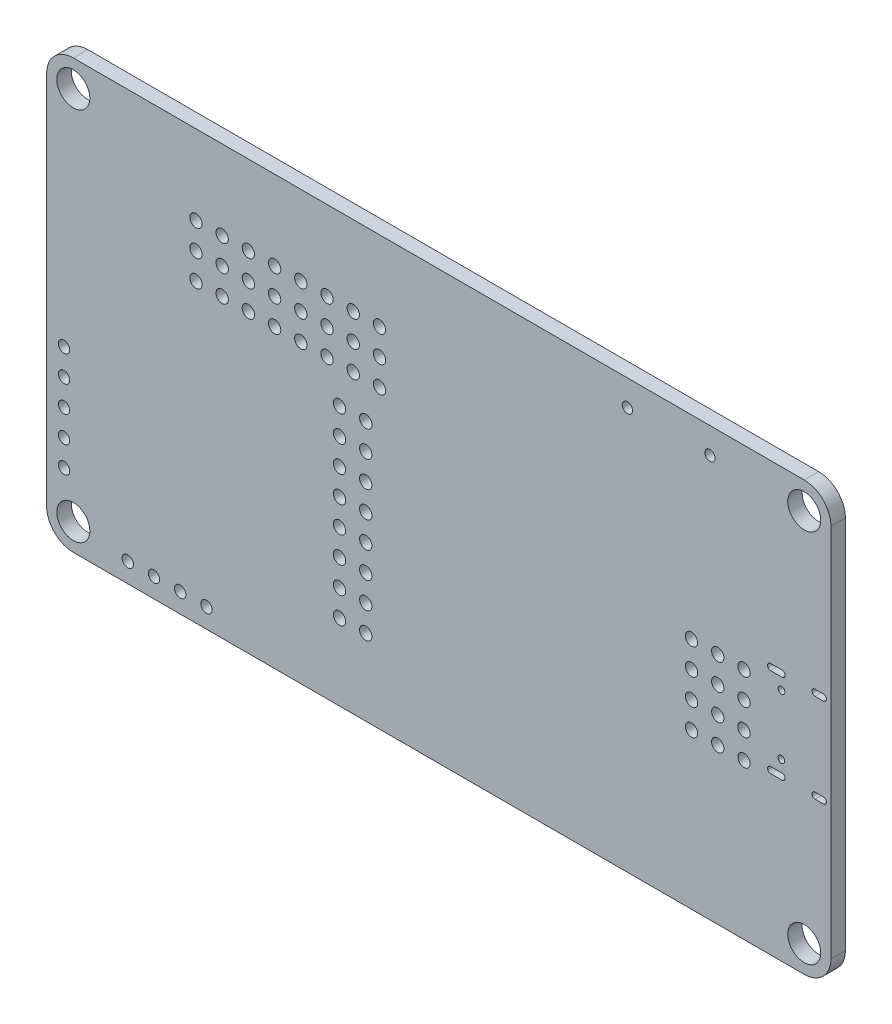
from build123d import *

# Parameters (mm, degrees)
SKETCH_1_R      = 1.6
SKETCH_1_R_2    = 0.599441199
SKETCH_1_R_3    = 0.6
SKETCH_1_R_4    = 0.5
SKETCH_1_R_5    = 0.32499365
SKETCH_1_R_6    = 0.5500127
EXTRUDE_1_DEPTH = 1.399034798


with BuildPart() as part:
    # 草图1 → 凸台-拉伸1 (new body)
    with BuildSketch(Plane.XY.offset(1.399034798)):
        with BuildLine():
            Line((40.06507493, 133.362966726), (110.86507493, 133.362966726))
            ThreePointArc((110.86507493, 133.362966726), (112.694572287, 134.120769344), (113.452374905, 135.950266701))
            Line((113.452374905, 135.950266701), (113.452374905, 172.250266701))
            ThreePointArc((113.452374905, 172.250266701), (112.694572287, 174.079764058), (110.86507493, 174.837566675))
            Line((110.86507493, 174.837566675), (40.06507493, 174.837566675))
            ThreePointArc((40.06507493, 174.837566675), (38.235577573, 174.079764058), (37.477774956, 172.250266701))
            Line((37.477774956, 172.250266701), (37.477774956, 135.950266701))
            ThreePointArc((37.477774956, 135.950266701), (38.235577573, 134.120769344), (40.06507493, 133.362966726))
        make_face()
        with Locations(Location((40.06507493, 172.250266701, 0), (0, 0, 180))):
            Circle(SKETCH_1_R, mode=Mode.SUBTRACT)
        with Locations(Location((51.943103886, 167.132334265, 0), (0, 0, 180))):
            Circle(SKETCH_1_R_2, mode=Mode.SUBTRACT)
        with Locations(Location((54.483108966, 167.132334265, 0), (0, 0, 180))):
            Circle(SKETCH_1_R_2, mode=Mode.SUBTRACT)
        with Locations(Location((57.023114046, 167.132334265, 0), (0, 0, 180))):
            Circle(SKETCH_1_R_2, mode=Mode.SUBTRACT)
        with Locations(Location((51.943103886, 164.592329185, 0), (0, 0, 180))):
            Circle(SKETCH_1_R_2, mode=Mode.SUBTRACT)
        with Locations(Location((54.483108966, 164.592329185, 0), (0, 0, 180))):
            Circle(SKETCH_1_R_2, mode=Mode.SUBTRACT)
        with Locations(Location((57.023114046, 164.592329185, 0), (0, 0, 180))):
            Circle(SKETCH_1_R_2, mode=Mode.SUBTRACT)
        with Locations(Location((59.563119126, 167.132334265, 0), (0, 0, 180))):
            Circle(SKETCH_1_R_2, mode=Mode.SUBTRACT)
        with Locations(Location((62.103124206, 167.132334265, 0), (0, 0, 180))):
            Circle(SKETCH_1_R_2, mode=Mode.SUBTRACT)
        with Locations(Location((64.643129286, 167.132334265, 0), (0, 0, 180))):
            Circle(SKETCH_1_R_2, mode=Mode.SUBTRACT)
        with Locations(Location((59.563119126, 164.592329185, 0), (0, 0, 180))):
            Circle(SKETCH_1_R_2, mode=Mode.SUBTRACT)
        with Locations(Location((62.103124206, 164.592329185, 0), (0, 0, 180))):
            Circle(SKETCH_1_R_2, mode=Mode.SUBTRACT)
        with Locations(Location((64.643129286, 164.592329185, 0), (0, 0, 180))):
            Circle(SKETCH_1_R_2, mode=Mode.SUBTRACT)
        with Locations(Location((67.183134366, 167.132334265, 0), (0, 0, 180))):
            Circle(SKETCH_1_R_2, mode=Mode.SUBTRACT)
        with Locations(Location((69.723139446, 167.132334265, 0), (0, 0, 180))):
            Circle(SKETCH_1_R_2, mode=Mode.SUBTRACT)
        with Locations(Location((67.183134366, 164.592329185, 0), (0, 0, 180))):
            Circle(SKETCH_1_R_2, mode=Mode.SUBTRACT)
        with Locations(Location((69.723139446, 164.592329185, 0), (0, 0, 180))):
            Circle(SKETCH_1_R_2, mode=Mode.SUBTRACT)
        with Locations(Location((51.943103886, 162.052324105, 0), (0, 0, 180))):
            Circle(SKETCH_1_R_2, mode=Mode.SUBTRACT)
        with Locations(Location((54.483108966, 162.052324105, 0), (0, 0, 180))):
            Circle(SKETCH_1_R_2, mode=Mode.SUBTRACT)
        with Locations(Location((57.023114046, 162.052324105, 0), (0, 0, 180))):
            Circle(SKETCH_1_R_2, mode=Mode.SUBTRACT)
        with Locations(Location((59.563119126, 162.052324105, 0), (0, 0, 180))):
            Circle(SKETCH_1_R_2, mode=Mode.SUBTRACT)
        with Locations(Location((62.103124206, 162.052324105, 0), (0, 0, 180))):
            Circle(SKETCH_1_R_2, mode=Mode.SUBTRACT)
        with Locations(Location((64.643129286, 162.052324105, 0), (0, 0, 180))):
            Circle(SKETCH_1_R_2, mode=Mode.SUBTRACT)
        with Locations(Location((67.183134366, 162.052324105, 0), (0, 0, 180))):
            Circle(SKETCH_1_R_2, mode=Mode.SUBTRACT)
        with Locations(Location((69.723139446, 162.052324105, 0), (0, 0, 180))):
            Circle(SKETCH_1_R_2, mode=Mode.SUBTRACT)
        with Locations(Location((65.851363983, 158.524160528, 0), (0, 0, 180))):
            Circle(SKETCH_1_R_3, mode=Mode.SUBTRACT)
        with Locations(Location((65.851363983, 155.984155448, 0), (0, 0, 180))):
            Circle(SKETCH_1_R_3, mode=Mode.SUBTRACT)
        with Locations(Location((68.391369063, 158.524160528, 0), (0, 0, 180))):
            Circle(SKETCH_1_R_3, mode=Mode.SUBTRACT)
        with Locations(Location((68.391369063, 155.984155448, 0), (0, 0, 180))):
            Circle(SKETCH_1_R_3, mode=Mode.SUBTRACT)
        with Locations(Location((93.734188468, 172.334264669, 0), (0, 0, 180))):
            Circle(SKETCH_1_R_4, mode=Mode.SUBTRACT)
        with Locations(Location((101.734188468, 172.334264669, 0), (0, 0, 180))):
            Circle(SKETCH_1_R_4, mode=Mode.SUBTRACT)
        with Locations(Location((110.86507493, 172.250266701, 0), (0, 0, 180))):
            Circle(SKETCH_1_R, mode=Mode.SUBTRACT)
        with Locations(Location((99.949199898, 156.01981204, 0), (0, 0, 180))):
            Circle(SKETCH_1_R_2, mode=Mode.SUBTRACT)
        with Locations(Location((102.489204978, 156.01981204, 0), (0, 0, 180))):
            Circle(SKETCH_1_R_2, mode=Mode.SUBTRACT)
        with Locations(Location((105.029210058, 156.01981204, 0), (0, 0, 180))):
            Circle(SKETCH_1_R_2, mode=Mode.SUBTRACT)
        with Locations(Location((108.662529845, 156.095684531, 0), (0, 0, 180))):
            Circle(SKETCH_1_R_5, mode=Mode.SUBTRACT)
        with Locations(Location((39.168275337, 150.163637287, 0), (0, 0, 180))):
            Circle(SKETCH_1_R_6, mode=Mode.SUBTRACT)
        with Locations(Location((39.168275337, 147.623632207, 0), (0, 0, 180))):
            Circle(SKETCH_1_R_6, mode=Mode.SUBTRACT)
        with Locations(Location((39.168275337, 145.083627127, 0), (0, 0, 180))):
            Circle(SKETCH_1_R_6, mode=Mode.SUBTRACT)
        with Locations(Location((65.851363983, 153.444150368, 0), (0, 0, 180))):
            Circle(SKETCH_1_R_3, mode=Mode.SUBTRACT)
        with Locations(Location((65.851363983, 150.904145288, 0), (0, 0, 180))):
            Circle(SKETCH_1_R_3, mode=Mode.SUBTRACT)
        with Locations(Location((68.391369063, 153.444150368, 0), (0, 0, 180))):
            Circle(SKETCH_1_R_3, mode=Mode.SUBTRACT)
        with Locations(Location((68.391369063, 150.904145288, 0), (0, 0, 180))):
            Circle(SKETCH_1_R_3, mode=Mode.SUBTRACT)
        with Locations(Location((65.851363983, 148.364140208, 0), (0, 0, 180))):
            Circle(SKETCH_1_R_3, mode=Mode.SUBTRACT)
        with Locations(Location((65.851363983, 145.824135128, 0), (0, 0, 180))):
            Circle(SKETCH_1_R_3, mode=Mode.SUBTRACT)
        with Locations(Location((68.391369063, 148.364140208, 0), (0, 0, 180))):
            Circle(SKETCH_1_R_3, mode=Mode.SUBTRACT)
        with Locations(Location((68.391369063, 145.824135128, 0), (0, 0, 180))):
            Circle(SKETCH_1_R_3, mode=Mode.SUBTRACT)
        with Locations(Location((39.168275337, 142.543622047, 0), (0, 0, 180))):
            Circle(SKETCH_1_R_6, mode=Mode.SUBTRACT)
        with Locations(Location((39.168275337, 140.003616967, 0), (0, 0, 180))):
            Circle(SKETCH_1_R_6, mode=Mode.SUBTRACT)
        with Locations(Location((40.06507493, 135.950266701, 0), (0, 0, 180))):
            Circle(SKETCH_1_R, mode=Mode.SUBTRACT)
        with Locations(Location((45.339090678, 135.255270511, 0), (0, 0, 180))):
            Circle(SKETCH_1_R_6, mode=Mode.SUBTRACT)
        with Locations(Location((47.879095758, 135.255270511, 0), (0, 0, 180))):
            Circle(SKETCH_1_R_6, mode=Mode.SUBTRACT)
        with Locations(Location((50.419100838, 135.255270511, 0), (0, 0, 180))):
            Circle(SKETCH_1_R_6, mode=Mode.SUBTRACT)
        with Locations(Location((52.959105918, 135.255270511, 0), (0, 0, 180))):
            Circle(SKETCH_1_R_6, mode=Mode.SUBTRACT)
        with Locations(Location((65.851363983, 143.284130048, 0), (0, 0, 180))):
            Circle(SKETCH_1_R_3, mode=Mode.SUBTRACT)
        with Locations(Location((65.851363983, 140.744124968, 0), (0, 0, 180))):
            Circle(SKETCH_1_R_3, mode=Mode.SUBTRACT)
        with Locations(Location((68.391369063, 143.284130048, 0), (0, 0, 180))):
            Circle(SKETCH_1_R_3, mode=Mode.SUBTRACT)
        with Locations(Location((68.391369063, 140.744124968, 0), (0, 0, 180))):
            Circle(SKETCH_1_R_3, mode=Mode.SUBTRACT)
        with Locations(Location((99.949199898, 153.47980696, 0), (0, 0, 180))):
            Circle(SKETCH_1_R_2, mode=Mode.SUBTRACT)
        with Locations(Location((102.489204978, 153.47980696, 0), (0, 0, 180))):
            Circle(SKETCH_1_R_2, mode=Mode.SUBTRACT)
        with Locations(Location((99.949199898, 150.93980188, 0), (0, 0, 180))):
            Circle(SKETCH_1_R_2, mode=Mode.SUBTRACT)
        with Locations(Location((102.489204978, 150.93980188, 0), (0, 0, 180))):
            Circle(SKETCH_1_R_2, mode=Mode.SUBTRACT)
        with Locations(Location((105.029210058, 153.47980696, 0), (0, 0, 180))):
            Circle(SKETCH_1_R_2, mode=Mode.SUBTRACT)
        with Locations(Location((105.029210058, 150.93980188, 0), (0, 0, 180))):
            Circle(SKETCH_1_R_2, mode=Mode.SUBTRACT)
        with Locations(Location((108.652369825, 150.295836932, 0), (0, 0, 180))):
            Circle(SKETCH_1_R_5, mode=Mode.SUBTRACT)
        with Locations(Location((99.949199898, 148.3997968, 0), (0, 0, 180))):
            Circle(SKETCH_1_R_2, mode=Mode.SUBTRACT)
        with Locations(Location((102.489204978, 148.3997968, 0), (0, 0, 180))):
            Circle(SKETCH_1_R_2, mode=Mode.SUBTRACT)
        with Locations(Location((105.029210058, 148.3997968, 0), (0, 0, 180))):
            Circle(SKETCH_1_R_2, mode=Mode.SUBTRACT)
        with Locations(Location((110.86507493, 135.950266701, 0), (0, 0, 180))):
            Circle(SKETCH_1_R, mode=Mode.SUBTRACT)
        with BuildLine():
            Line((107.612402845, 157.815801372), (108.712402845, 157.815801372))
            ThreePointArc((108.712402845, 157.815801372), (109.012402845, 157.515801372), (108.712402845, 157.215801372))
            Line((108.712402845, 157.215801372), (107.612402845, 157.215801372))
            ThreePointArc((107.612402845, 157.215801372), (107.312402845, 157.515801372), (107.612402845, 157.815801372))
        make_face(mode=Mode.SUBTRACT)
        with BuildLine():
            Line((111.912517145, 157.815801372), (112.712517145, 157.815801372))
            ThreePointArc((112.712517145, 157.815801372), (113.012517145, 157.515801372), (112.712517145, 157.215801372))
            Line((112.712517145, 157.215801372), (111.912517145, 157.215801372))
            ThreePointArc((111.912517145, 157.215801372), (111.612517145, 157.515801372), (111.912517145, 157.815801372))
        make_face(mode=Mode.SUBTRACT)
        with BuildLine():
            Line((107.612402845, 149.175720091), (108.712402845, 149.175720091))
            ThreePointArc((108.712402845, 149.175720091), (109.012402845, 148.875720091), (108.712402845, 148.575720091))
            Line((108.712402845, 148.575720091), (107.612402845, 148.575720091))
            ThreePointArc((107.612402845, 148.575720091), (107.312402845, 148.875720091), (107.612402845, 149.175720091))
        make_face(mode=Mode.SUBTRACT)
        with BuildLine():
            Line((111.912517145, 149.175720091), (112.712517145, 149.175720091))
            ThreePointArc((112.712517145, 149.175720091), (113.012517145, 148.875720091), (112.712517145, 148.575720091))
            Line((112.712517145, 148.575720091), (111.912517145, 148.575720091))
            ThreePointArc((111.912517145, 148.575720091), (111.612517145, 148.875720091), (111.912517145, 149.175720091))
        make_face(mode=Mode.SUBTRACT)
    extrude(amount=-EXTRUDE_1_DEPTH)


solid = part.part
